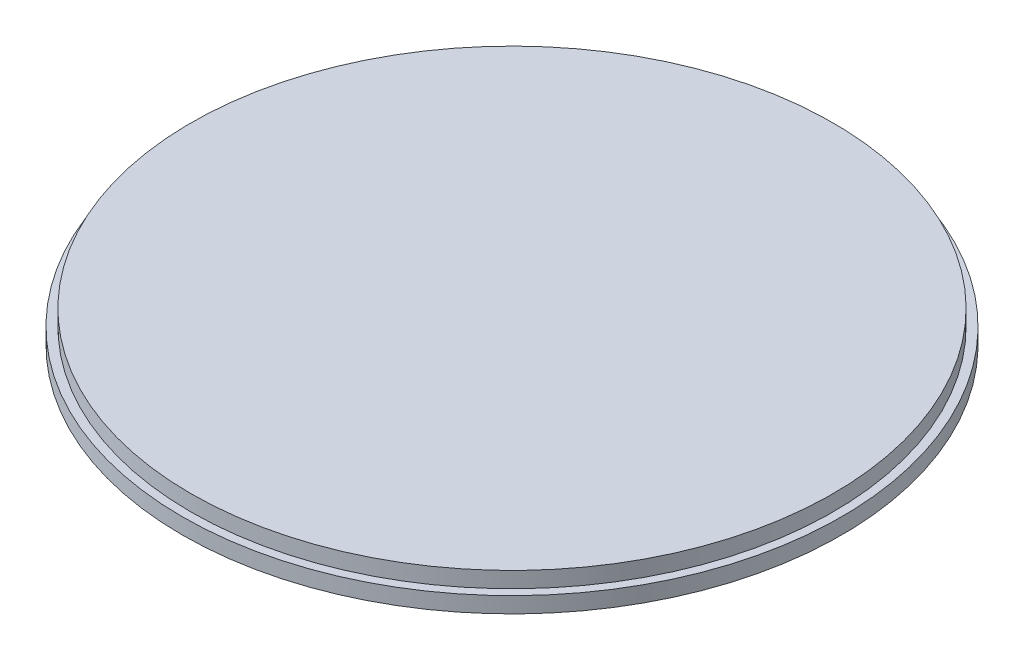
from build123d import *


with BuildPart() as part:
    # Sketch1 → Revolve1 (revolve)
    with BuildSketch(Plane.XY, mode=Mode.PRIVATE) as revolve1_sk:
        Polygon((0, 0), (49.53, 0), (49.53, 2.38125), (48.26, 2.38125), (48.26, 4.7625), (0, 4.7625), align=None)
    revolve(revolve1_sk.sketch.rotate(Axis((0, 4.7625, 0), (0, -1, 0)), 90), axis=Axis((0, 4.7625, 0), (0, -1, 0)))


solid = part.part
